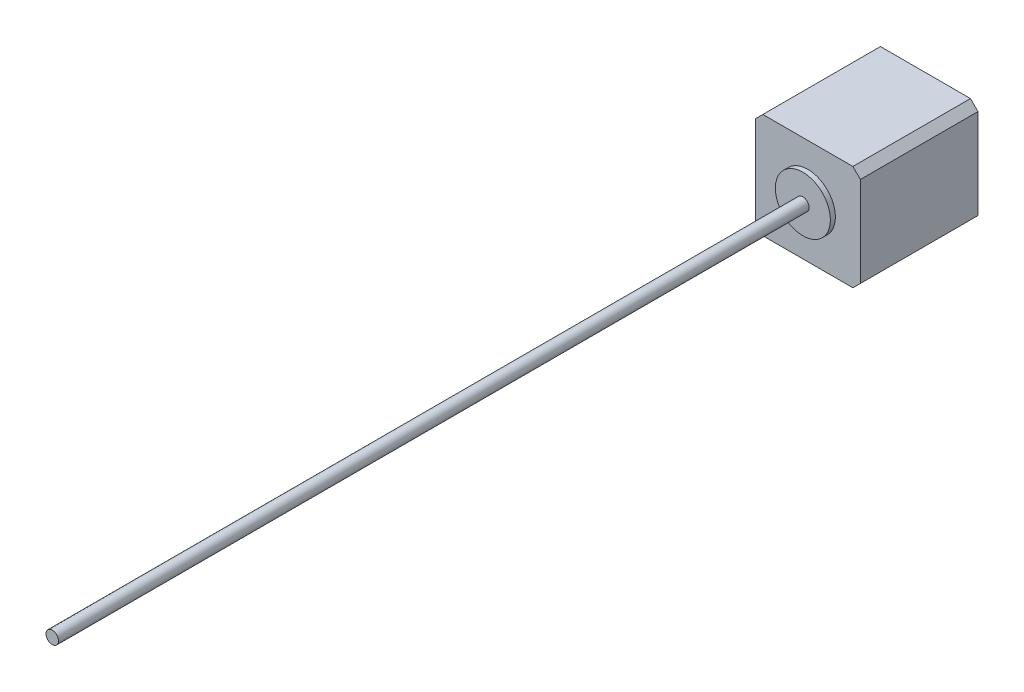
from build123d import *

# Parameters (mm, degrees)
SKETCH_1_W      = 42
SKETCH_1_H      = 42
EXTRUDE_1_DEPTH = 47
CHAMFER_1_SIZE  = 3
SKETCH_2_R      = 11
EXTRUDE_2_DEPTH = 2
SKETCH_3_R      = 2.5
EXTRUDE_3_DEPTH = 300


with BuildPart() as part:
    # 草图1 → 凸台-拉伸1 (new body)
    with BuildSketch(Plane.XY):
        with Locations((-21, 21)):
            Rectangle(SKETCH_1_W, SKETCH_1_H)
    extrude(amount=EXTRUDE_1_DEPTH)

    # 倒角1
    chamfer_1_edges = [part.edges().sort_by_distance(p)[0] for p in [
        (0, 0, 23.5),
        (-42, 0, 23.5),
        (-42, 42, 23.5),
        (0, 42, 23.5),
    ]]
    chamfer(chamfer_1_edges, length=CHAMFER_1_SIZE)

    # 草图2 → 凸台-拉伸2 (add)
    with BuildSketch(Plane.XY.offset(47)):
        with Locations((-21, 21)):
            Circle(SKETCH_2_R)
    extrude(amount=EXTRUDE_2_DEPTH)

    # 草图3 → 凸台-拉伸3 (add)
    with BuildSketch(Plane.XY.offset(49)):
        with Locations((-21, 21)):
            Circle(SKETCH_3_R)
    extrude(amount=EXTRUDE_3_DEPTH)


solid = part.part
